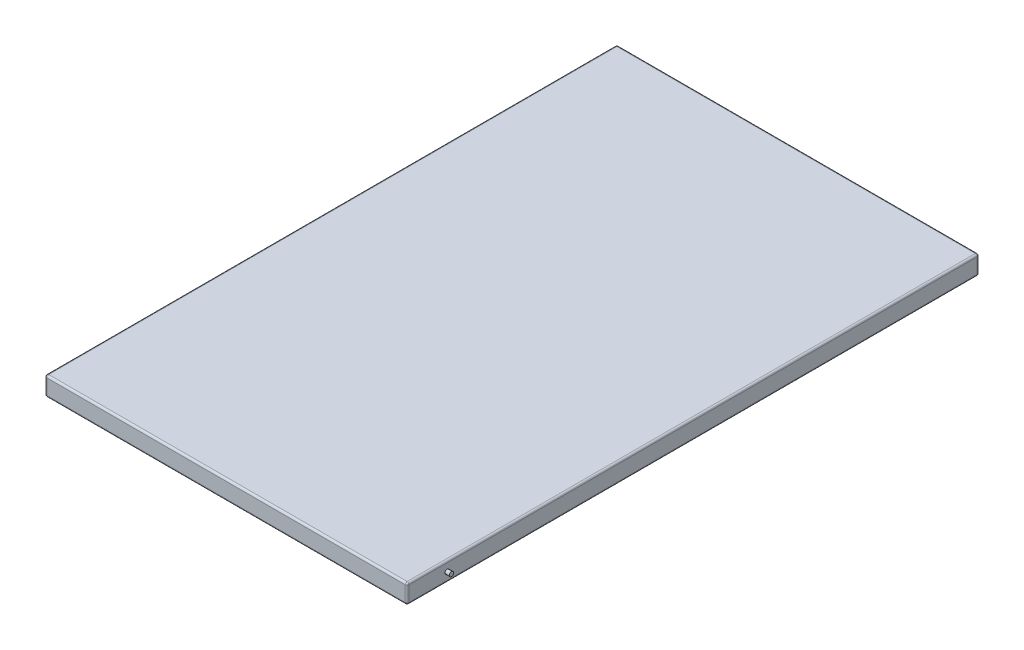
from build123d import *

# Parameters (mm, degrees)
SKETCH1_W           = 380
SKETCH1_H           = 20
BOSS_EXTRUDE1_DEPTH = 600
FILLET1_R           = 2
SKETCH3_R           = 2.25
BOSS_EXTRUDE3_DEPTH = 4.5


with BuildPart() as part:
    # Sketch1 → Boss-Extrude1 (new body)
    with BuildSketch(Plane.XY):
        with Locations((0, 10)):
            Rectangle(SKETCH1_W, SKETCH1_H)
    extrude(amount=-BOSS_EXTRUDE1_DEPTH)

    # Fillet1
    fillet1_edges = [part.edges().sort_by_distance(p)[0] for p in [
        (190, 10, -600),
        (0, 20, -600),
        (-190, 10, -600),
        (0, 20, 0),
        (190, 10, 0),
        (0, 0, 0),
        (-190, 10, 0),
        (-190, 20, -300),
        (190, 20, -300),
        (190, 0, -300),
        (-190, 0, -300),
        (0, 0, -600),
    ]]
    fillet(fillet1_edges, radius=FILLET1_R)

    # Sketch3 → Boss-Extrude3 (add)
    with BuildSketch(Plane(origin=(190, 0, 0), x_dir=(0, 0, -1), z_dir=(1, 0, 0))):
        with Locations((42, 10)):
            Circle(SKETCH3_R)
    extrude(amount=BOSS_EXTRUDE3_DEPTH)


solid = part.part
